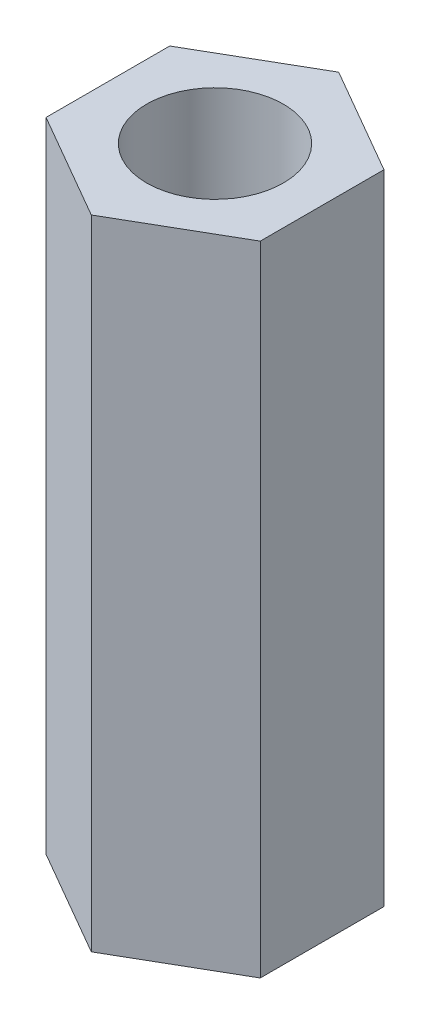
from build123d import *

# Parameters (mm, degrees)
SKETCH_1_R      = 1.5
EXTRUDE_1_DEPTH = 14


with BuildPart() as part:
    # 草图1 → 凸台-拉伸1 (new body)
    with BuildSketch(Plane(origin=(0, 0, 0), x_dir=(1, 0, 0), z_dir=(0, 1, 0))):
        Polygon((0, -2.713546265), (2.35, -1.356773133), (2.35, 1.356773133), (0, 2.713546265), (-2.35, 1.356773133), (-2.35, -1.356773133), align=None)
        with Locations(Location((0, 0, 0), (0, 0, 270))):
            Circle(SKETCH_1_R, mode=Mode.SUBTRACT)
    extrude(amount=EXTRUDE_1_DEPTH)


solid = part.part
